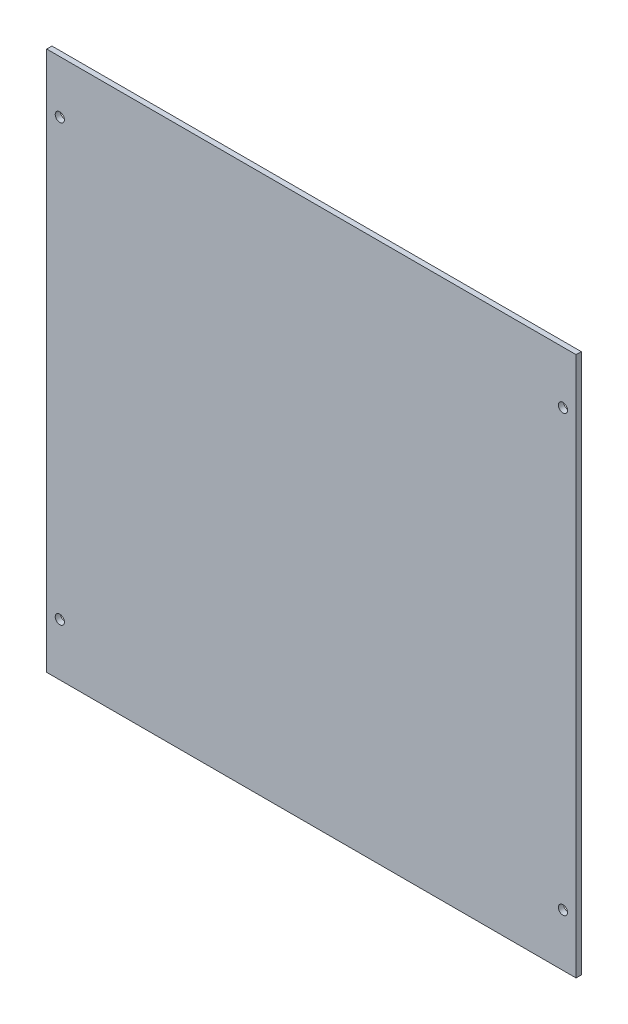
from build123d import *

# Parameters (mm, degrees)
SKETCH1_W           = 202
SKETCH1_H           = 206
SKETCH1_R           = 1.75
BOSS_EXTRUDE1_DEPTH = 2


with BuildPart() as part:
    # Sketch1 → Boss-Extrude1 (new body)
    with BuildSketch(Plane.XY):
        with Locations((101, 103)):
            Rectangle(SKETCH1_W, SKETCH1_H)
        with Locations((5, 186)):
            Circle(SKETCH1_R, mode=Mode.SUBTRACT)
        with Locations((197, 186)):
            Circle(SKETCH1_R, mode=Mode.SUBTRACT)
        with Locations((5, 20)):
            Circle(SKETCH1_R, mode=Mode.SUBTRACT)
        with Locations((197, 20)):
            Circle(SKETCH1_R, mode=Mode.SUBTRACT)
    extrude(amount=BOSS_EXTRUDE1_DEPTH)


solid = part.part
